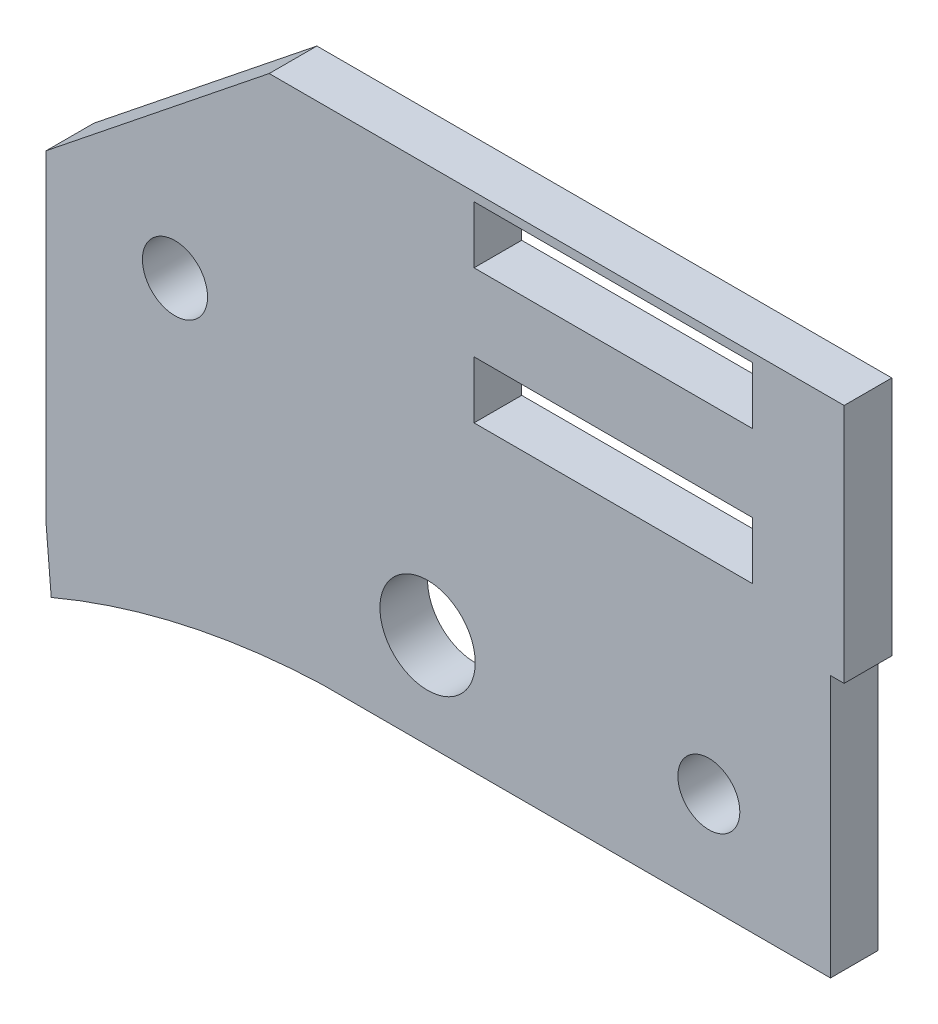
from build123d import *

# Parameters (mm, degrees)
SKETCH_1_R      = 3
SKETCH_1_R_2    = 1.95
SKETCH_1_R_3    = 2.05
SKETCH_1_W      = 17.535566723
SKETCH_1_H      = 3.6
EXTRUDE_1_DEPTH = 3


with BuildPart() as part:
    # 스케치1 → 보스-돌출1 (new body)
    with BuildSketch(Plane.XY):
        with BuildLine():
            Line((14.033980913, 31.631973376), (0, 20.408728084))
            Line((0, 20.408728084), (0, 0))
            Line((0, 0), (0.315433782, -3.780966668))
            ThreePointArc((0.315433782, -3.780966668), (8.660717355, -1.110252043), (17.352311853, 0))
            Line((17.352311853, 0), (49.356011681, 0))
            Line((49.356011681, 0), (49.356011681, 16.484705835))
            Line((49.356011681, 16.484705835), (50.213133896, 16.484705835))
            Line((50.213133896, 16.484705835), (50.213133896, 31.631973376))
            Line((50.213133896, 31.631973376), (14.033980913, 31.631973376))
        make_face()
        with Locations((24, 6)):
            Circle(SKETCH_1_R, mode=Mode.SUBTRACT)
        with Locations((41.7, 6.2)):
            Circle(SKETCH_1_R_2, mode=Mode.SUBTRACT)
        with Locations((8.103885944, 17.512168243)):
            Circle(SKETCH_1_R_3, mode=Mode.SUBTRACT)
        with Locations((35.691910847, 29.288073102)):
            Rectangle(SKETCH_1_W, SKETCH_1_H, mode=Mode.SUBTRACT)
        with Locations((35.691910847, 20.838073102)):
            Rectangle(SKETCH_1_W, SKETCH_1_H, mode=Mode.SUBTRACT)
    extrude(amount=EXTRUDE_1_DEPTH)


solid = part.part
